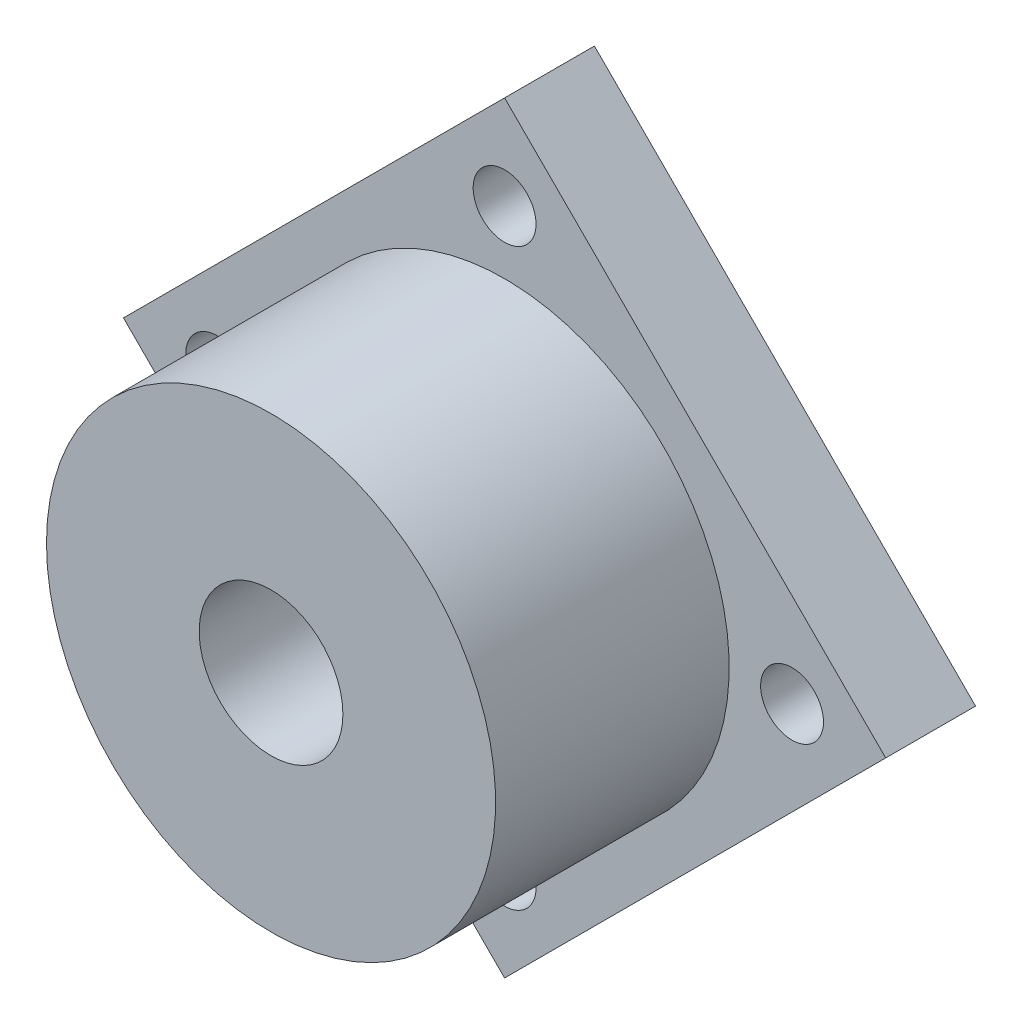
from build123d import *

# Parameters (mm, degrees)
SKETCH_1_R          = 4
EXTRUDE_1_DEPTH     = 5
SKETCH_2_R          = 1.75
CUT_EXTRUDE_1_DEPTH = 5
SKETCH_3_R          = 12.5
SKETCH_3_R_2        = 4
EXTRUDE_2_DEPTH     = 13


with BuildPart() as part:
    # 草图1 → 凸台-拉伸1 (new body)
    with BuildSketch(Plane.XY):
        Polygon((0, 21.213203436), (-21.213203436, 0), (0, -21.213203436), (21.213203436, 0), align=None)
        Circle(SKETCH_1_R, mode=Mode.SUBTRACT)
    extrude(amount=EXTRUDE_1_DEPTH)

    # 草图2 → 切除-拉伸1 (cut)
    with BuildSketch(Plane.XY.offset(5)):
        with Locations((16, 0)):
            Circle(SKETCH_2_R)
        with Locations((0, -16)):
            Circle(SKETCH_2_R)
        with Locations((-16, 0)):
            Circle(SKETCH_2_R)
        with Locations((0, 16)):
            Circle(SKETCH_2_R)
    extrude(amount=-CUT_EXTRUDE_1_DEPTH, mode=Mode.SUBTRACT)

    # 草图3 → 凸台-拉伸2 (add)
    with BuildSketch(Plane.XY.offset(5)):
        with Locations(Location((0, 0, 0), (0, 0, 180))):
            Circle(SKETCH_3_R)
        Circle(SKETCH_3_R_2, mode=Mode.SUBTRACT)
    extrude(amount=EXTRUDE_2_DEPTH)


solid = part.part
